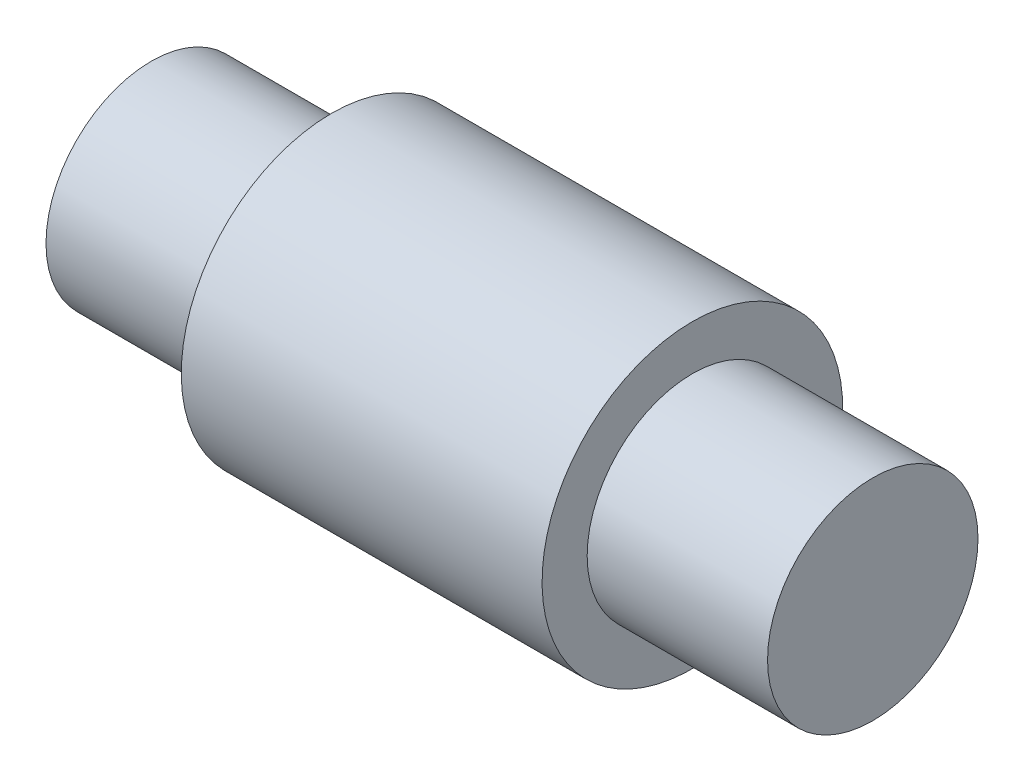
from build123d import *


with BuildPart() as part:
    # Sketch1 → Revolve1 (revolve)
    with BuildSketch(Plane.XY):
        Polygon((0, 0), (0, 3.5), (6, 3.5), (6, 5), (18, 5), (18, 3.5), (24, 3.5), (24, 0), align=None)
    revolve(axis=Axis((24, 0, 0), (-1, 0, 0)))


solid = part.part
